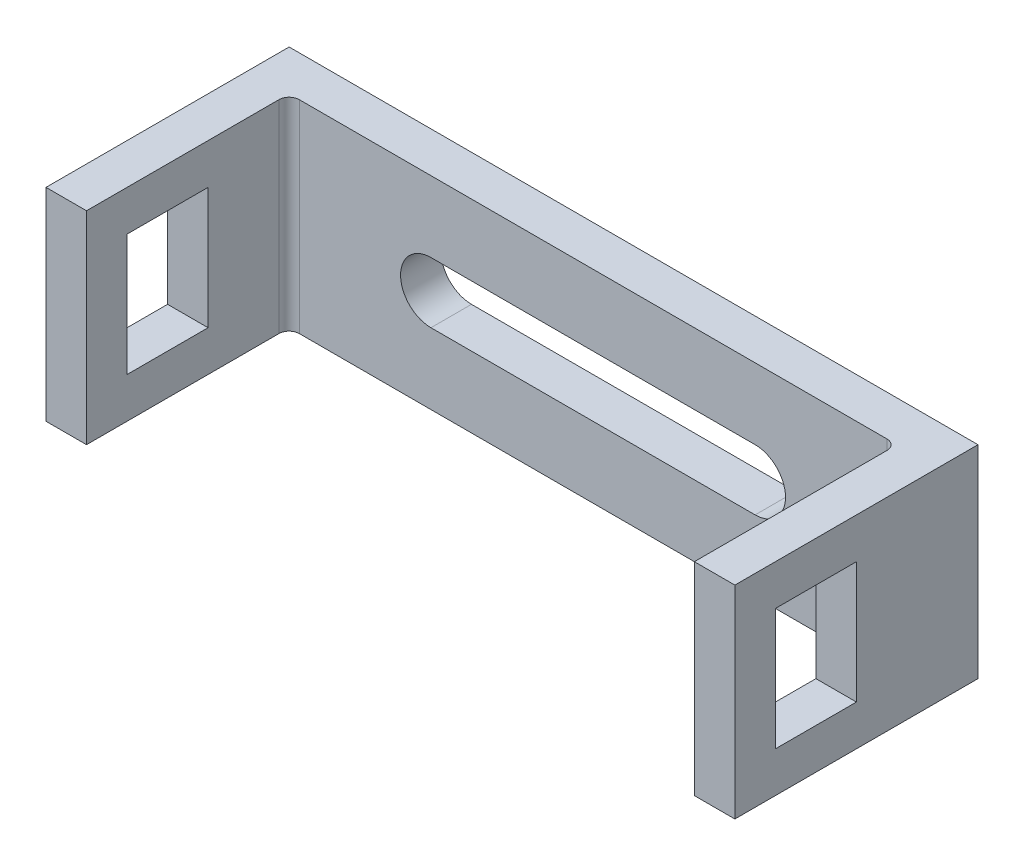
from build123d import *

# Parameters (mm, degrees)
SKETCH1_W               = 34
SKETCH1_H               = 10
BOSS_EXTRUDE1_DEPTH     = 2
SKETCH2_W               = 2
SKETCH2_H               = 10
BOSS_EXTRUDE2_DEPTH     = 10
FILLET1_R               = 0.5
CUT_EXTRUDE1_DEPTH      = 37.400549446
CUT_EXTRUDE1_DEPTH_BACK = 37.400549446
SKETCH3_W               = 4
SKETCH3_H               = 6
CUT_EXTRUDE2_DEPTH      = 22.400934559
CUT_EXTRUDE2_DEPTH_BACK = 22.400934559


with BuildPart() as part:
    # Sketch1 → Boss-Extrude1 (new body)
    with BuildSketch(Plane.XY):
        Rectangle(SKETCH1_W, SKETCH1_H)
    extrude(amount=BOSS_EXTRUDE1_DEPTH)

    # Sketch2 → Boss-Extrude2 (add)
    with BuildSketch(Plane.XY.offset(2)):
        with Locations((-16, 0)):
            Rectangle(SKETCH2_W, SKETCH2_H)
        with Locations((16, 0)):
            Rectangle(SKETCH2_W, SKETCH2_H)
    extrude(amount=BOSS_EXTRUDE2_DEPTH)

    # Fillet1
    fillet1_edges = [part.edges().sort_by_distance(p)[0] for p in [
        (-15, 0, 2),
        (15, 0, 2),
    ]]
    fillet(fillet1_edges, radius=FILLET1_R)

    # Sketch3 → Cut-Extrude1 (cut, two sides: drawn at the far end of the back side and taken through both)
    with BuildSketch(Plane(origin=(17, 0, 0), x_dir=(0, 0, -1), z_dir=(1, 0, 0)).offset(-CUT_EXTRUDE1_DEPTH_BACK)):
        with Locations((-8, 0)):
            Rectangle(SKETCH3_W, SKETCH3_H)
    extrude(amount=CUT_EXTRUDE1_DEPTH + CUT_EXTRUDE1_DEPTH_BACK, mode=Mode.SUBTRACT)

    # Sketch4 → Cut-Extrude2 (cut, two sides: drawn at the far end of the back side and taken through both)
    with BuildSketch(Plane(origin=(0, 0, 0), x_dir=(-1, 0, 0), z_dir=(0, 0, -1)).offset(-CUT_EXTRUDE2_DEPTH_BACK)):
        with BuildLine():
            Line((-8, -1.5), (8, -1.5))
            ThreePointArc((8, -1.5), (9.5, 0), (8, 1.5))
            Line((8, 1.5), (-8, 1.5))
            ThreePointArc((-8, 1.5), (-9.5, 0), (-8, -1.5))
        make_face()
    extrude(amount=CUT_EXTRUDE2_DEPTH + CUT_EXTRUDE2_DEPTH_BACK, mode=Mode.SUBTRACT)


solid = part.part
